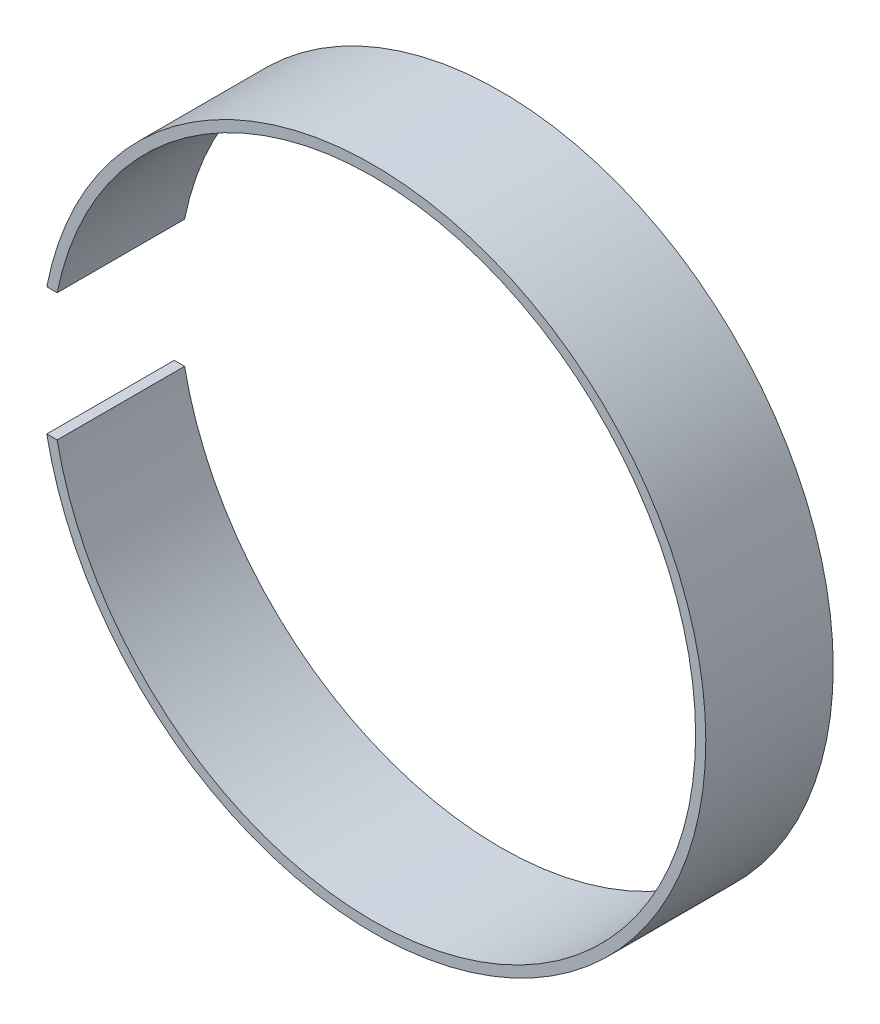
from build123d import *

# Parameters (mm, degrees)
BOSS_EXTRUDE1_DEPTH = 250


with BuildPart() as part:
    # Sketch1 → Boss-Extrude1 (new body)
    with BuildSketch(Plane.XY):
        with BuildLine():
            Line((-640.414904574, -125), (-620.025201101, -125))
            ThreePointArc((-620.025201101, -125), (632.5, 0), (-620.025201101, 125))
            Line((-620.025201101, 125), (-640.414904574, 125))
            ThreePointArc((-640.414904574, 125), (652.5, 0), (-640.414904574, -125))
        make_face()
    extrude(amount=BOSS_EXTRUDE1_DEPTH)


solid = part.part
